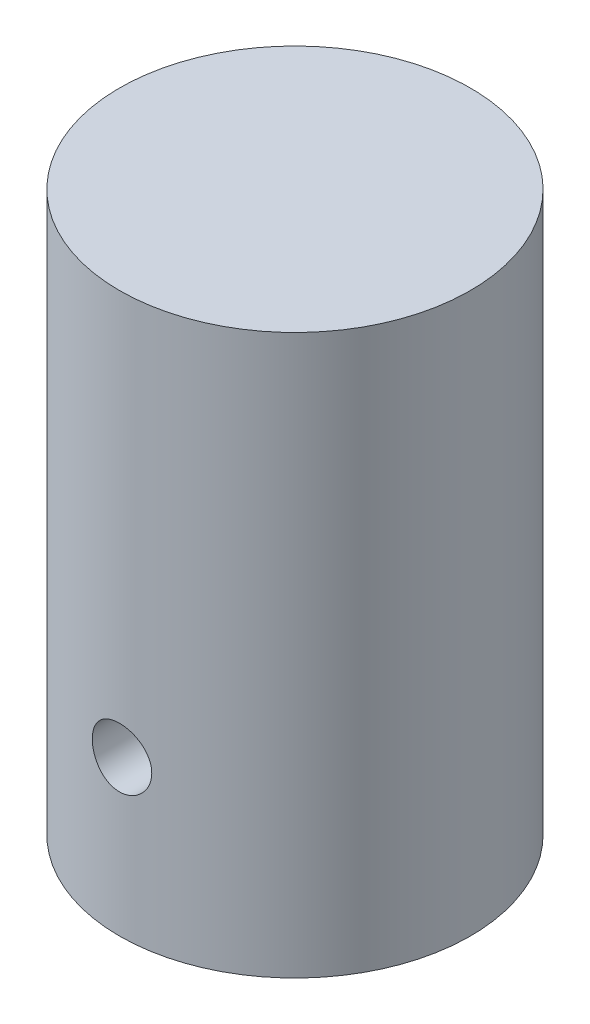
from build123d import *

# Parameters (mm, degrees)
SKETCH1_R           = 37.465
BOSS_EXTRUDE1_DEPTH = 119.38
SKETCH3_R           = 6.35
CUT_EXTRUDE1_DEPTH  = 19.05
SKETCH4_R           = 6.35
CUT_EXTRUDE2_DEPTH  = 19.05


with BuildPart() as part:
    # Sketch1 → Boss-Extrude1 (new body)
    with BuildSketch(Plane(origin=(0, 0, 0), x_dir=(1, 0, 0), z_dir=(0, 1, 0))):
        with Locations(Location((0, 0, 0), (0, 0, 90))):
            Circle(SKETCH1_R)
    extrude(amount=BOSS_EXTRUDE1_DEPTH)

    # Sketch3 → Cut-Extrude1 (cut)
    with BuildSketch(Plane.XY.offset(37.465)):
        with Locations((0, 33.02)):
            Circle(SKETCH3_R)
    extrude(amount=-CUT_EXTRUDE1_DEPTH, mode=Mode.SUBTRACT)

    # Sketch4 → Cut-Extrude2 (cut)
    with BuildSketch(Plane.XZ):
        with Locations(Location((0, 0, 0), (0, 0, 270))):
            Circle(SKETCH4_R)
    extrude(amount=-CUT_EXTRUDE2_DEPTH, mode=Mode.SUBTRACT)


solid = part.part
